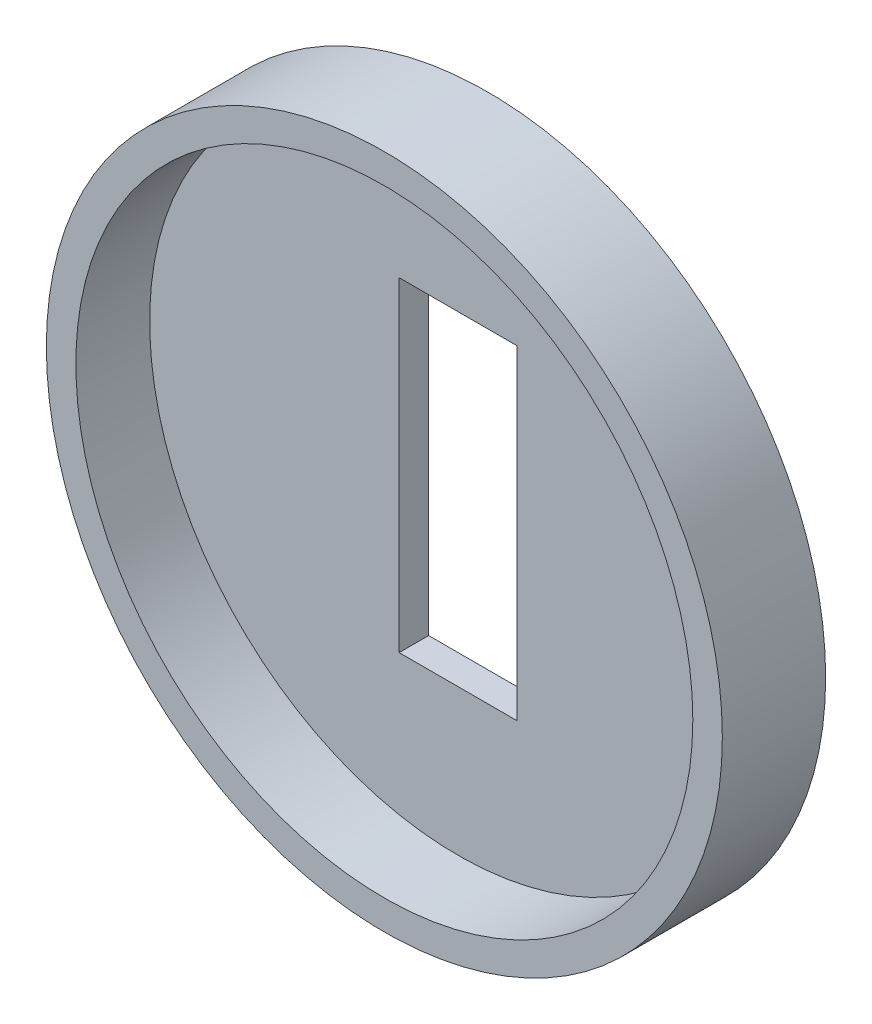
from build123d import *

# Parameters (mm, degrees)
SKIZZE2_W                       = 8
SKIZZE2_H                       = 22
SCHNITT_LINEAR_AUSTRAGEN1_DEPTH = 10


with BuildPart() as part:
    # Skizze1 → Rotation2 (revolve)
    with BuildSketch(Plane(origin=(0, 0, 0), x_dir=(1, 0, 0), z_dir=(0, 1, 0))):
        Polygon((0, 0), (22.902, 0), (22.902, -7), (20.902, -7), (20.902, -2), (0, -2), align=None)
    revolve(axis=Axis((0, 0, 2), (0, 0, -1)))

    # Skizze2 → Schnitt-Linear austragen1 (cut)
    with BuildSketch(Plane(origin=(0, 0, 0), x_dir=(-1, 0, 0), z_dir=(0, 0, -1))):
        Rectangle(SKIZZE2_W, SKIZZE2_H)
    extrude(amount=-SCHNITT_LINEAR_AUSTRAGEN1_DEPTH, mode=Mode.SUBTRACT)


solid = part.part
